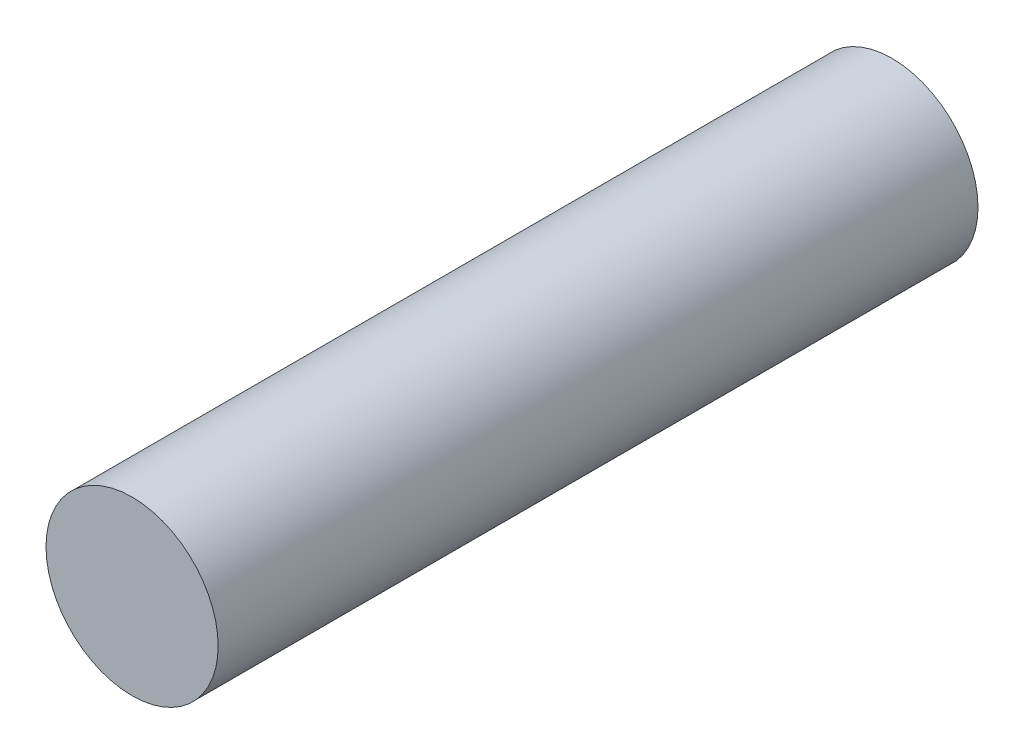
from build123d import *

# Parameters (mm, degrees)
SKETCH1_R           = 1.0795
BOSS_EXTRUDE1_DEPTH = 9.53008


with BuildPart() as part:
    # Sketch1 → Boss-Extrude1 (new body)
    with BuildSketch(Plane.XY):
        Circle(SKETCH1_R)
    extrude(amount=BOSS_EXTRUDE1_DEPTH)


solid = part.part
